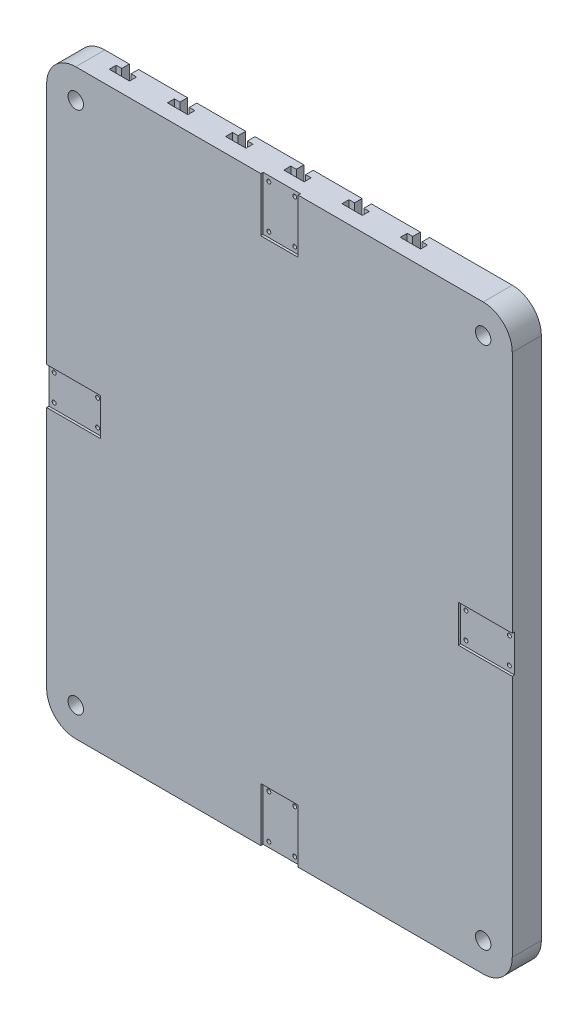
from build123d import *

# Parameters (mm, degrees)
SKETCH_1_W                  = 800
SKETCH_1_H                  = 1000
EXTRUDE_1_DEPTH             = 50
CUT_EXTRUDE_1_DEPTH         = 1079.192932642
PATTERN_LINEAR_1_COUNT      = 4
PATTERN_LINEAR_1_PITCH      = 100
PATTERN_LINEAR_1_COL_COUNT  = 3
PATTERN_LINEAR_1_COL_PITCH  = 100
FILLET_1_R                  = 50
SKETCH_5_W                  = 64
SKETCH_5_H                  = 92.5
SKETCH_5_W_2                = 92.5
SKETCH_5_H_2                = 64
CUT_EXTRUDE_2_DEPTH         = 4
HOLE_WIZARD_M30_1_D         = 26.5
HOLE_WIZARD_M30_1_DEPTH     = 70.5
HOLE_WIZARD_M30_1_TIP       = 7.961403202
HOLE_WIZARD_M8_1_D          = 6.8
HOLE_WIZARD_M8_1_DEPTH      = 19.75
HOLE_WIZARD_M8_1_TIP        = 2.042926105
HOLE_WIZARD_M8_2_AT_2_COUNT = 2
HOLE_WIZARD_M8_2_AT_2_PITCH = 44.5
HOLE_WIZARD_M8_2_AT_3_COUNT = 2
HOLE_WIZARD_M8_2_AT_3_PITCH = 86.864319487
HOLE_WIZARD_M8_2_AT_4_COUNT = 2
HOLE_WIZARD_M8_2_AT_4_PITCH = 74.6
HOLE_WIZARD_M8_3_AT_2_COUNT = 2
HOLE_WIZARD_M8_3_AT_2_PITCH = 44.5
HOLE_WIZARD_M8_3_AT_3_COUNT = 2
HOLE_WIZARD_M8_3_AT_3_PITCH = 86.864319487
HOLE_WIZARD_M8_3_AT_4_COUNT = 2
HOLE_WIZARD_M8_3_AT_4_PITCH = 74.6


with BuildPart() as part:
    # 草图1 → 凸台-拉伸1 (new body)
    with BuildSketch(Plane.XY):
        Rectangle(SKETCH_1_W, SKETCH_1_H)
    extrude(amount=EXTRUDE_1_DEPTH)

    # 草图3 → 切除-拉伸1 (cut, through all)
    with BuildSketch(Plane(origin=(0, 500, 0), x_dir=(1, 0, 0), z_dir=(0, 1, 0))):
        Polygon((-8, 0), (8, 0), (8, -13), (17.5, -13), (17.5, -25), (-17.5, -25), (-17.5, -13), (-8, -13), align=None)
    cut_extrude_1 = extrude(amount=-CUT_EXTRUDE_1_DEPTH, mode=Mode.SUBTRACT)

    # 阵列(线性)1: 切除-拉伸1 ×4
    with Locations(*[(-i * PATTERN_LINEAR_1_PITCH, 0, 0) for i in range(1, PATTERN_LINEAR_1_COUNT)]):
        add(cut_extrude_1, mode=Mode.SUBTRACT)

    # 阵列(线性)1 col: 切除-拉伸1 ×3
    with Locations(*[(i * PATTERN_LINEAR_1_COL_PITCH, 0, 0) for i in range(1, PATTERN_LINEAR_1_COL_COUNT)]):
        add(cut_extrude_1, mode=Mode.SUBTRACT)

    # 圆角1
    fillet_1_edges = [part.edges().sort_by_distance(p)[0] for p in [
        (400, -500, 25),
        (-400, -500, 25),
        (-400, 500, 25),
        (400, 500, 25),
    ]]
    fillet(fillet_1_edges, radius=FILLET_1_R)

    # 草图5 → 切除-拉伸2 (cut)
    with BuildSketch(Plane.XY.offset(50)):
        with Locations((0, 453.75)):
            Rectangle(SKETCH_5_W, SKETCH_5_H)
        with Locations((-353.75, 0)):
            Rectangle(SKETCH_5_W_2, SKETCH_5_H_2)
        with Locations((353.75, 0)):
            Rectangle(SKETCH_5_W_2, SKETCH_5_H_2)
        with Locations((0, -453.75)):
            Rectangle(SKETCH_5_W, SKETCH_5_H)
    extrude(amount=-CUT_EXTRUDE_2_DEPTH, mode=Mode.SUBTRACT)

    # M30 螺纹孔1
    with Locations(Plane.XY.offset(50)):
        with Locations((-350, 450), (350, 450), (350, -450), (-350, -450)):
            Hole(HOLE_WIZARD_M30_1_D / 2, depth=HOLE_WIZARD_M30_1_DEPTH)
            with Locations((0, 0, -(HOLE_WIZARD_M30_1_DEPTH + HOLE_WIZARD_M30_1_TIP / 2))):  # 118° drill point
                Cone(0, HOLE_WIZARD_M30_1_D / 2, HOLE_WIZARD_M30_1_TIP, mode=Mode.SUBTRACT)

    # M8 螺纹孔1
    with Locations(Plane(origin=(0, 0, 0), x_dir=(-1, 0, 0), z_dir=(0, 0, -1))):
        with Locations((-375, -165), (-375, 165)):
            Hole(HOLE_WIZARD_M8_1_D / 2, depth=HOLE_WIZARD_M8_1_DEPTH)
            with Locations((0, 0, -(HOLE_WIZARD_M8_1_DEPTH + HOLE_WIZARD_M8_1_TIP / 2))):  # 118° drill point
                Cone(0, HOLE_WIZARD_M8_1_D / 2, HOLE_WIZARD_M8_1_TIP, mode=Mode.SUBTRACT)

    # 草图12 → M8 螺纹孔2 (revolve, cut)
    with BuildSketch(Plane(origin=(-22.25, 416.45, 46), x_dir=(0, -1, 0), z_dir=(1, 0, 0))):
        Polygon((0, 0), (0, 19.792926105), (3.4, 17.75), (3.4, 0), align=None)
    hole_wizard_m8_2 = revolve(axis=Axis((-22.25, 416.45, 52.35), (0, 0, -1)), mode=Mode.SUBTRACT)

    # M8 螺纹孔2 at 2: M8 螺纹孔2 ×2
    with Locations(*[(i * HOLE_WIZARD_M8_2_AT_2_PITCH, 0, 0) for i in range(1, HOLE_WIZARD_M8_2_AT_2_COUNT)]):
        add(hole_wizard_m8_2, mode=Mode.SUBTRACT)

    # M8 螺纹孔2 at 3: M8 螺纹孔2 ×2
    with Locations(*[Vector(0.5122931977436572, 0.8588106191388054, 0) * (i * HOLE_WIZARD_M8_2_AT_3_PITCH) for i in range(1, HOLE_WIZARD_M8_2_AT_3_COUNT)]):
        add(hole_wizard_m8_2, mode=Mode.SUBTRACT)

    # M8 螺纹孔2 at 4: M8 螺纹孔2 ×2
    with Locations(*[(0, i * HOLE_WIZARD_M8_2_AT_4_PITCH, 0) for i in range(1, HOLE_WIZARD_M8_2_AT_4_COUNT)]):
        add(hole_wizard_m8_2, mode=Mode.SUBTRACT)

    # 镜向1: M8 螺纹孔2 across plane
    add(hole_wizard_m8_2.mirror(Plane.ZX), mode=Mode.SUBTRACT)

    # 镜向1 copy 1 sketch → 镜向1 copy 1 (revolve, cut)
    with BuildSketch(Plane(origin=(22.25, -416.45, 46), x_dir=(0, 1, 0), z_dir=(1, 0, 0))):
        Polygon((0, 0), (0, -19.792926105), (3.4, -17.75), (3.4, 0), align=None)
    revolve(axis=Axis((22.25, -416.45, 52.35), (0, 0, 1)), mode=Mode.SUBTRACT)

    # 镜向1 copy 2 sketch → 镜向1 copy 2 (revolve, cut)
    with BuildSketch(Plane(origin=(22.25, -491.05, 46), x_dir=(0, 1, 0), z_dir=(1, 0, 0))):
        Polygon((0, 0), (0, -19.792926105), (3.4, -17.75), (3.4, 0), align=None)
    revolve(axis=Axis((22.25, -491.05, 52.35), (0, 0, 1)), mode=Mode.SUBTRACT)

    # 镜向1 copy 3 sketch → 镜向1 copy 3 (revolve, cut)
    with BuildSketch(Plane(origin=(-22.25, -491.05, 46), x_dir=(0, 1, 0), z_dir=(1, 0, 0))):
        Polygon((0, 0), (0, -19.792926105), (3.4, -17.75), (3.4, 0), align=None)
    revolve(axis=Axis((-22.25, -491.05, 52.35), (0, 0, 1)), mode=Mode.SUBTRACT)

    # 草图14 → M8 螺纹孔3 (revolve, cut)
    with BuildSketch(Plane(origin=(-391.05, -22.25, 46), x_dir=(0, -1, 0), z_dir=(1, 0, 0))):
        Polygon((0, 0), (0, 19.792926105), (3.4, 17.75), (3.4, 0), align=None)
    hole_wizard_m8_3 = revolve(axis=Axis((-391.05, -22.25, 52.35), (0, 0, -1)), mode=Mode.SUBTRACT)

    # M8 螺纹孔3 at 2: M8 螺纹孔3 ×2
    with Locations(*[(0, i * HOLE_WIZARD_M8_3_AT_2_PITCH, 0) for i in range(1, HOLE_WIZARD_M8_3_AT_2_COUNT)]):
        add(hole_wizard_m8_3, mode=Mode.SUBTRACT)

    # M8 螺纹孔3 at 3: M8 螺纹孔3 ×2
    with Locations(*[Vector(0.8588106191388053, 0.5122931977436572, 0) * (i * HOLE_WIZARD_M8_3_AT_3_PITCH) for i in range(1, HOLE_WIZARD_M8_3_AT_3_COUNT)]):
        add(hole_wizard_m8_3, mode=Mode.SUBTRACT)

    # M8 螺纹孔3 at 4: M8 螺纹孔3 ×2
    with Locations(*[(i * HOLE_WIZARD_M8_3_AT_4_PITCH, 0, 0) for i in range(1, HOLE_WIZARD_M8_3_AT_4_COUNT)]):
        add(hole_wizard_m8_3, mode=Mode.SUBTRACT)

    # 镜向2: M8 螺纹孔3 across plane
    add(hole_wizard_m8_3.mirror(Plane(origin=(0, 0, 0), x_dir=(0, 0, 1), z_dir=(1, 0, 0))), mode=Mode.SUBTRACT)

    # 镜向2 copy 1 sketch → 镜向2 copy 1 (revolve, cut)
    with BuildSketch(Plane(origin=(391.05, 22.25, 46), x_dir=(0, -1, 0), z_dir=(-1, 0, 0))):
        Polygon((0, 0), (0, -19.792926105), (3.4, -17.75), (3.4, 0), align=None)
    revolve(axis=Axis((391.05, 22.25, 52.35), (0, 0, 1)), mode=Mode.SUBTRACT)

    # 镜向2 copy 2 sketch → 镜向2 copy 2 (revolve, cut)
    with BuildSketch(Plane(origin=(316.45, 22.25, 46), x_dir=(0, -1, 0), z_dir=(-1, 0, 0))):
        Polygon((0, 0), (0, -19.792926105), (3.4, -17.75), (3.4, 0), align=None)
    revolve(axis=Axis((316.45, 22.25, 52.35), (0, 0, 1)), mode=Mode.SUBTRACT)

    # 镜向2 copy 3 sketch → 镜向2 copy 3 (revolve, cut)
    with BuildSketch(Plane(origin=(316.45, -22.25, 46), x_dir=(0, -1, 0), z_dir=(-1, 0, 0))):
        Polygon((0, 0), (0, -19.792926105), (3.4, -17.75), (3.4, 0), align=None)
    revolve(axis=Axis((316.45, -22.25, 52.35), (0, 0, 1)), mode=Mode.SUBTRACT)


solid = part.part
